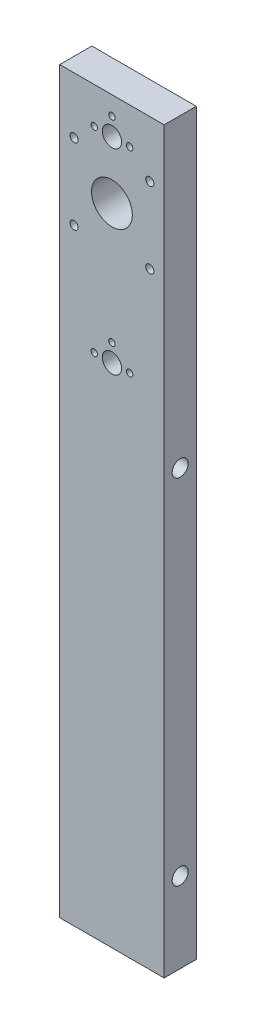
from build123d import *

# Parameters (mm, degrees)
SKETCH1_W           = 65
SKETCH1_H           = 460
SKETCH1_R           = 2.54
SKETCH1_R_2         = 6
SKETCH1_R_3         = 2
SKETCH1_R_4         = 12.7
BOSS_EXTRUDE1_DEPTH = 20
SKETCH2_R           = 5
CUT_EXTRUDE1_DEPTH  = 40


with BuildPart() as part:
    # Sketch1 → Boss-Extrude1 (new body)
    with BuildSketch(Plane.XY):
        with Locations((0, -191.425)):
            Rectangle(SKETCH1_W, SKETCH1_H)
        with Locations((-23.5712, 3.5712)):
            Circle(SKETCH1_R, mode=Mode.SUBTRACT)
        with Locations((23.5712, 3.5712)):
            Circle(SKETCH1_R, mode=Mode.SUBTRACT)
        with Locations((23.5712, -43.5712)):
            Circle(SKETCH1_R, mode=Mode.SUBTRACT)
        with Locations((-23.5712, -43.5712)):
            Circle(SKETCH1_R, mode=Mode.SUBTRACT)
        with Locations((0, -106)):
            Circle(SKETCH1_R_2, mode=Mode.SUBTRACT)
        with Locations((11, -106)):
            Circle(SKETCH1_R_3, mode=Mode.SUBTRACT)
        with Locations((0, -20)):
            Circle(SKETCH1_R_4, mode=Mode.SUBTRACT)
        with Locations((0, -95)):
            Circle(SKETCH1_R_3, mode=Mode.SUBTRACT)
        with Locations((0, 16)):
            Circle(SKETCH1_R_2, mode=Mode.SUBTRACT)
        with Locations((11, 16)):
            Circle(SKETCH1_R_3, mode=Mode.SUBTRACT)
        with Locations((-11, -106)):
            Circle(SKETCH1_R_3, mode=Mode.SUBTRACT)
        with Locations((0, 27)):
            Circle(SKETCH1_R_3, mode=Mode.SUBTRACT)
        with Locations((-11, 16)):
            Circle(SKETCH1_R_3, mode=Mode.SUBTRACT)
    extrude(amount=BOSS_EXTRUDE1_DEPTH)

    # Sketch2 → Cut-Extrude1 (cut, symmetric)
    with BuildSketch(Plane(origin=(0, 0, 0), x_dir=(0, 0, -1), z_dir=(1, 0, 0))):
        with Locations(Location((-10, -151.425, 0), (0, 0, 90))):
            Circle(SKETCH2_R)
        with Locations(Location((-10, -371.425, 0), (0, 0, 90))):
            Circle(SKETCH2_R)
    extrude(amount=CUT_EXTRUDE1_DEPTH, both=True, mode=Mode.SUBTRACT)


solid = part.part
